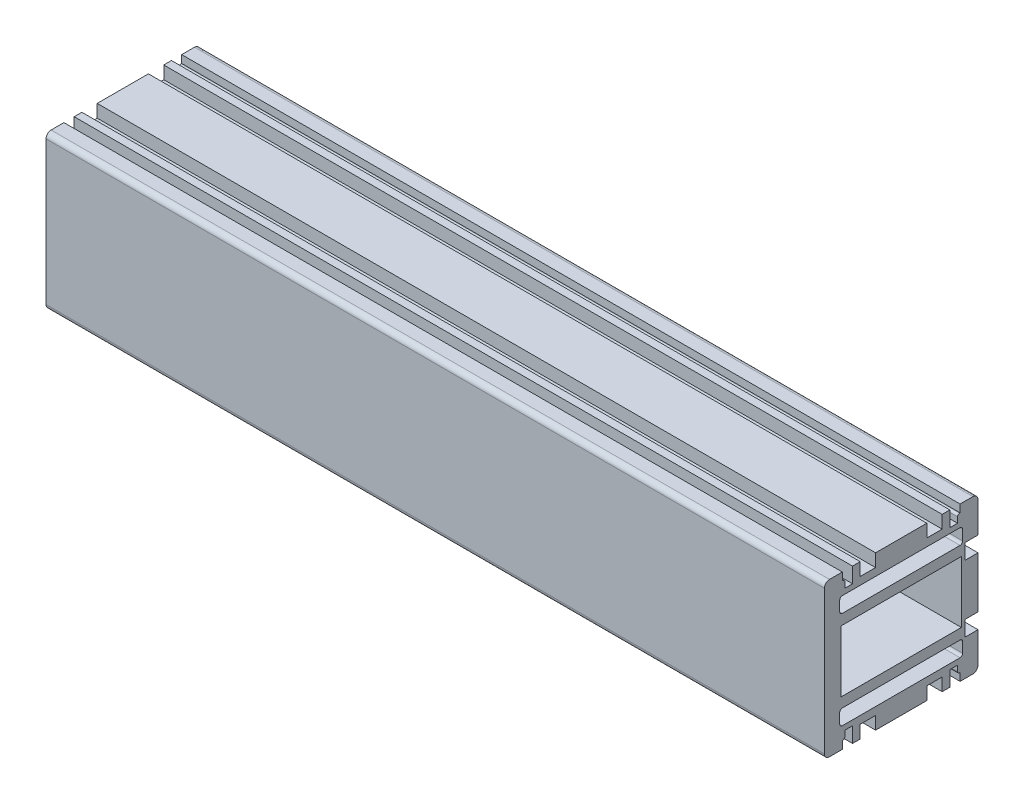
from build123d import *

# Parameters (mm, degrees)
SKETCH_1_W             = 23.5
SKETCH_1_H             = 12
EXTRUDE_1_DEPTH        = 76
HOLE_WIZARD_M6_1_D     = 5
HOLE_WIZARD_M6_1_DEPTH = 15
HOLE_WIZARD_M6_1_TIP   = 1.502151548
HOLE_WIZARD_M6_2_D     = 5
HOLE_WIZARD_M6_2_DEPTH = 15
HOLE_WIZARD_M6_2_TIP   = 1.502151548


with BuildPart() as part:
    # 草图1 → 凸台-拉伸1 (new, symmetric)
    with BuildSketch(Plane(origin=(0, 0, 0), x_dir=(0, 0, -1), z_dir=(1, 0, 0))):
        with BuildLine():
            Line((-14, 15), (-11.5, 15))
            Line((-11.5, 15), (-11.5, 13.5))
            Line((-11.5, 13.5), (-11.4, 13.5))
            ThreePointArc((-11.4, 13.5), (-11.117157288, 13.382842712), (-11, 13.1))
            Line((-11, 13.1), (-11, 12))
            Line((-11, 12), (-9.5, 12))
            Line((-9.5, 12), (-9.5, 15))
            Line((-9.5, 15), (-8, 15))
            Line((-8, 15), (-8, 12.5))
            Line((-8, 12.5), (-5, 12.5))
            Line((-5, 12.5), (-5, 15))
            Line((-5, 15), (5, 15))
            Line((5, 15), (5, 12.5))
            Line((5, 12.5), (8, 12.5))
            Line((8, 12.5), (8, 15))
            Line((8, 15), (9.5, 15))
            Line((9.5, 15), (9.5, 12))
            Line((9.5, 12), (11, 12))
            Line((11, 12), (11, 13.1))
            ThreePointArc((11, 13.1), (11.117157288, 13.382842712), (11.4, 13.5))
            Line((11.4, 13.5), (11.5, 13.5))
            Line((11.5, 13.5), (11.5, 15))
            Line((11.5, 15), (14, 15))
            ThreePointArc((14, 15), (14.707106781, 14.707106781), (15, 14))
            Line((15, 14), (15, 8))
            Line((15, 8), (12.5, 8))
            Line((12.5, 8), (12.5, 5))
            Line((12.5, 5), (15, 5))
            Line((15, 5), (15, -5))
            Line((15, -5), (12.5, -5))
            Line((12.5, -5), (12.5, -8))
            Line((12.5, -8), (15, -8))
            Line((15, -8), (15, -14))
            ThreePointArc((15, -14), (14.707106781, -14.707106781), (14, -15))
            Line((14, -15), (11.5, -15))
            Line((11.5, -15), (11.5, -13.5))
            Line((11.5, -13.5), (11.4, -13.5))
            ThreePointArc((11.4, -13.5), (11.117157288, -13.382842712), (11, -13.1))
            Line((11, -13.1), (11, -12))
            Line((11, -12), (9.5, -12))
            Line((9.5, -12), (9.5, -15))
            Line((9.5, -15), (8, -15))
            Line((8, -15), (8, -12.5))
            Line((8, -12.5), (5, -12.5))
            Line((5, -12.5), (5, -15))
            Line((5, -15), (-5, -15))
            Line((-5, -15), (-5, -12.5))
            Line((-5, -12.5), (-8, -12.5))
            Line((-8, -12.5), (-8, -15))
            Line((-8, -15), (-9.5, -15))
            Line((-9.5, -15), (-9.5, -12))
            Line((-9.5, -12), (-11, -12))
            Line((-11, -12), (-11, -13.1))
            ThreePointArc((-11, -13.1), (-11.117157288, -13.382842712), (-11.4, -13.5))
            Line((-11.4, -13.5), (-11.5, -13.5))
            Line((-11.5, -13.5), (-11.5, -15))
            Line((-11.5, -15), (-14, -15))
            ThreePointArc((-14, -15), (-14.707106781, -14.707106781), (-15, -14))
            Line((-15, -14), (-15, 14))
            ThreePointArc((-15, 14), (-14.707106781, 14.707106781), (-14, 15))
        make_face()
        with BuildLine():
            Line((12, -10.5), (12, -8.5))
            ThreePointArc((12, -8.5), (11.853553391, -8.146446609), (11.5, -8))
            Line((11.5, -8), (-11.5, -8))
            ThreePointArc((-11.5, -8), (-11.853553391, -8.146446609), (-12, -8.5))
            Line((-12, -8.5), (-12, -10.5))
            ThreePointArc((-12, -10.5), (-11.853553391, -10.853553391), (-11.5, -11))
            Line((-11.5, -11), (11.5, -11))
            ThreePointArc((11.5, -11), (11.853553391, -10.853553391), (12, -10.5))
        make_face(mode=Mode.SUBTRACT)
        with BuildLine():
            Line((-11.5, 11), (11.5, 11))
            ThreePointArc((11.5, 11), (11.853553391, 10.853553391), (12, 10.5))
            Line((12, 10.5), (12, 8.5))
            ThreePointArc((12, 8.5), (11.853553391, 8.146446609), (11.5, 8))
            Line((11.5, 8), (-11.5, 8))
            ThreePointArc((-11.5, 8), (-11.853553391, 8.146446609), (-12, 8.5))
            Line((-12, 8.5), (-12, 10.5))
            ThreePointArc((-12, 10.5), (-11.853553391, 10.853553391), (-11.5, 11))
        make_face(mode=Mode.SUBTRACT)
        Rectangle(SKETCH_1_W, SKETCH_1_H, mode=Mode.SUBTRACT)
    extrude(amount=EXTRUDE_1_DEPTH, both=True)

    # M6 螺纹孔1
    with Locations(Plane(origin=(0, 0, -15), x_dir=(-1, 0, 0), z_dir=(0, 0, -1))):
        with Locations((-56, 0), (-41, 0), (41, 0), (56, 0)):
            Hole(HOLE_WIZARD_M6_1_D / 2, depth=HOLE_WIZARD_M6_1_DEPTH)
            with Locations((0, 0, -(HOLE_WIZARD_M6_1_DEPTH + HOLE_WIZARD_M6_1_TIP / 2))):  # 118° drill point
                Cone(0, HOLE_WIZARD_M6_1_D / 2, HOLE_WIZARD_M6_1_TIP, mode=Mode.SUBTRACT)

    # M6 螺纹孔2
    with Locations(Plane.XZ.offset(15)):
        with Locations((56, 0), (41, 0), (-41, 0), (-56, 0)):
            Hole(HOLE_WIZARD_M6_2_D / 2, depth=HOLE_WIZARD_M6_2_DEPTH)
            with Locations((0, 0, -(HOLE_WIZARD_M6_2_DEPTH + HOLE_WIZARD_M6_2_TIP / 2))):  # 118° drill point
                Cone(0, HOLE_WIZARD_M6_2_D / 2, HOLE_WIZARD_M6_2_TIP, mode=Mode.SUBTRACT)


solid = part.part
